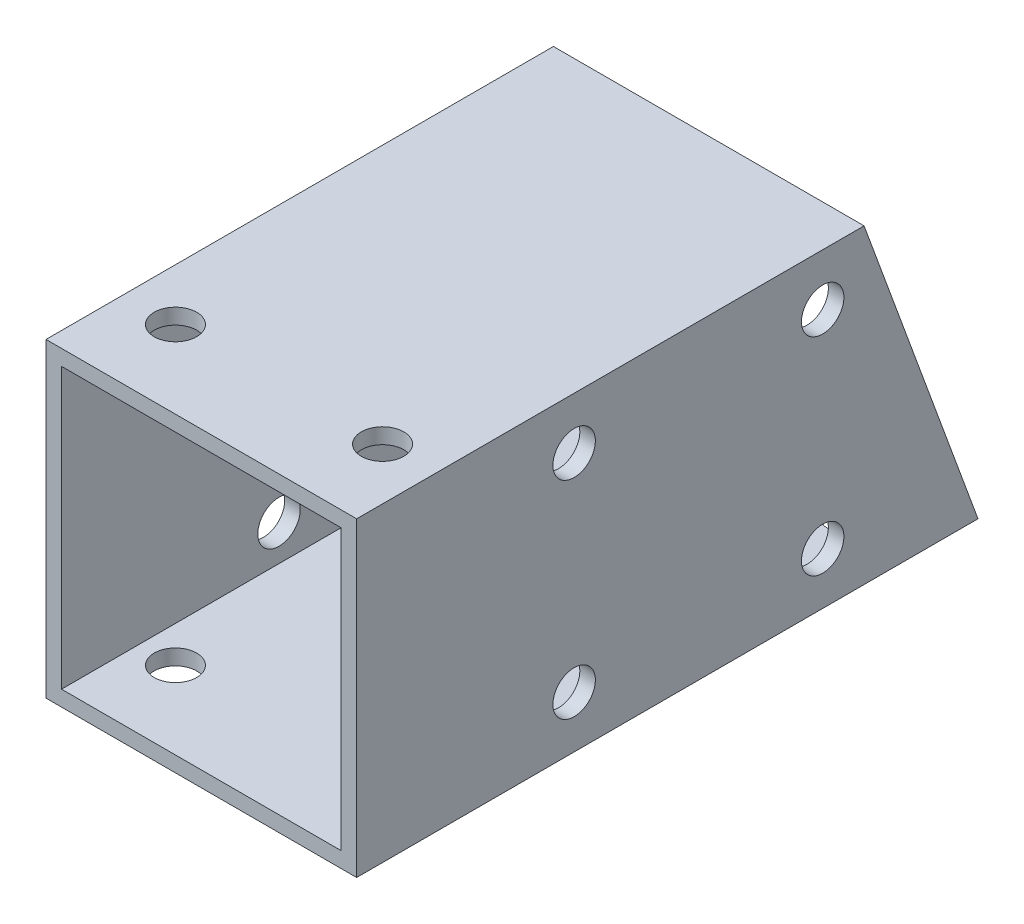
from build123d import *

# Parameters (mm, degrees)
SKETCH_1_W          = 30
SKETCH_1_H          = 30
SKETCH_1_W_2        = 27
SKETCH_1_H_2        = 27
EXTRUDE_1_DEPTH     = 60
SKETCH_2_R          = 2.05
CUT_EXTRUDE_1_DEPTH = 69.738635424
SKETCH_3_R          = 2.05
CUT_EXTRUDE_2_DEPTH = 69.738635424
CUT_EXTRUDE_4_DEPTH = 69.738635424


with BuildPart() as part:
    # 草图1 → 凸台-拉伸1 (new body)
    with BuildSketch(Plane.XY):
        Rectangle(SKETCH_1_W, SKETCH_1_H)
        Rectangle(SKETCH_1_W_2, SKETCH_1_H_2, mode=Mode.SUBTRACT)
    extrude(amount=EXTRUDE_1_DEPTH)

    # 草图2 → 切除-拉伸1 (cut, through all)
    with BuildSketch(Plane(origin=(0, 15, 0), x_dir=(1, 0, 0), z_dir=(0, 1, 0))):
        with Locations(Location((-10, -7.5, 0), (0, 0, 270))):
            Circle(SKETCH_2_R)
        with Locations(Location((10, -7.5, 0), (0, 0, 270))):
            Circle(SKETCH_2_R)
        with Locations(Location((-10, -52.5, 0), (0, 0, 270))):
            Circle(SKETCH_2_R)
        with Locations(Location((10, -52.5, 0), (0, 0, 270))):
            Circle(SKETCH_2_R)
    extrude(amount=-CUT_EXTRUDE_1_DEPTH, mode=Mode.SUBTRACT)

    # 草图3 → 切除-拉伸2 (cut, through all)
    with BuildSketch(Plane(origin=(15, 0, 0), x_dir=(0, 0, -1), z_dir=(1, 0, 0))):
        with Locations(Location((-39, 10, 0), (0, 0, 90))):
            Circle(SKETCH_3_R)
        with Locations(Location((-39, -10, 0), (0, 0, 90))):
            Circle(SKETCH_3_R)
        with Locations(Location((-15, -10, 0), (0, 0, 90))):
            Circle(SKETCH_3_R)
        with Locations(Location((-15, 10, 0), (0, 0, 90))):
            Circle(SKETCH_3_R)
    extrude(amount=-CUT_EXTRUDE_2_DEPTH, mode=Mode.SUBTRACT)

    # 草图5 → 切除-拉伸4 (cut, through all)
    with BuildSketch(Plane(origin=(15, 0, 0), x_dir=(0, 0, -1), z_dir=(1, 0, 0))):
        Polygon((0, -15), (-11, 15), (0, 15), align=None)
    extrude(amount=-CUT_EXTRUDE_4_DEPTH, mode=Mode.SUBTRACT)


solid = part.part
